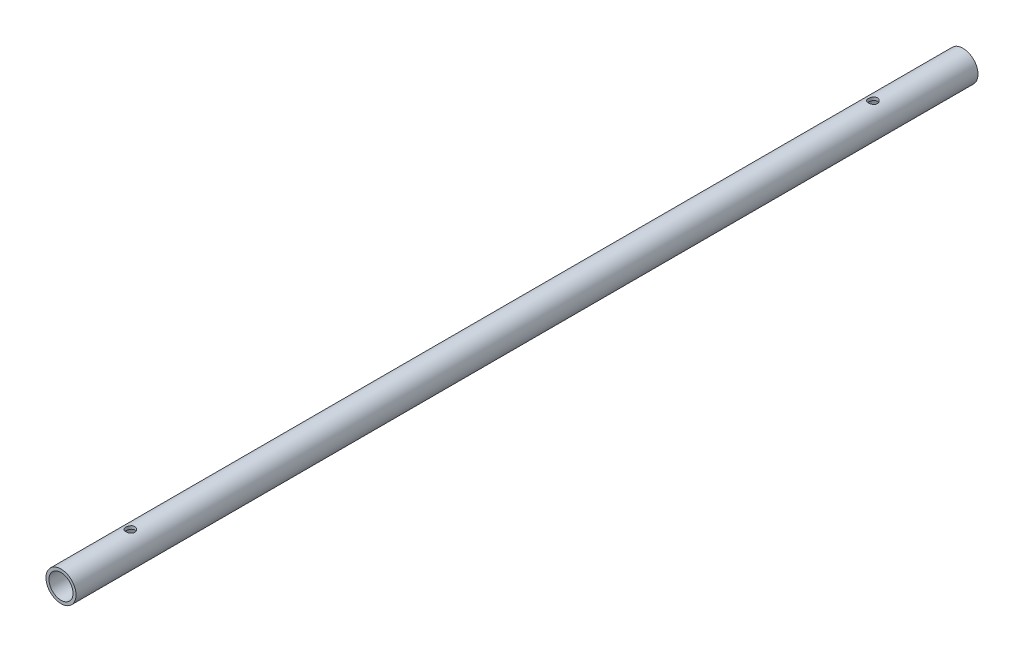
from build123d import *

# Parameters (mm, degrees)
SKETCH_1_R          = 5
SKETCH_1_R_2        = 4
EXTRUDE_1_DEPTH     = 300
SKETCH_2_R          = 1.5
CUT_EXTRUDE_1_DEPTH = 301.083321762


with BuildPart() as part:
    # 草图1 → 凸台-拉伸1 (new body)
    with BuildSketch(Plane.XY):
        Circle(SKETCH_1_R)
        Circle(SKETCH_1_R_2, mode=Mode.SUBTRACT)
    extrude(amount=EXTRUDE_1_DEPTH)

    # 草图2 → 切除-拉伸1 (cut, through all)
    with BuildSketch(Plane(origin=(0, 0, 0), x_dir=(1, 0, 0), z_dir=(0, 1, 0))):
        with Locations(Location((0, -277, 0), (0, 0, 90))):
            Circle(SKETCH_2_R)
        with Locations(Location((0, -30, 0), (0, 0, 90))):
            Circle(SKETCH_2_R)
    extrude(amount=CUT_EXTRUDE_1_DEPTH, mode=Mode.SUBTRACT)


solid = part.part
